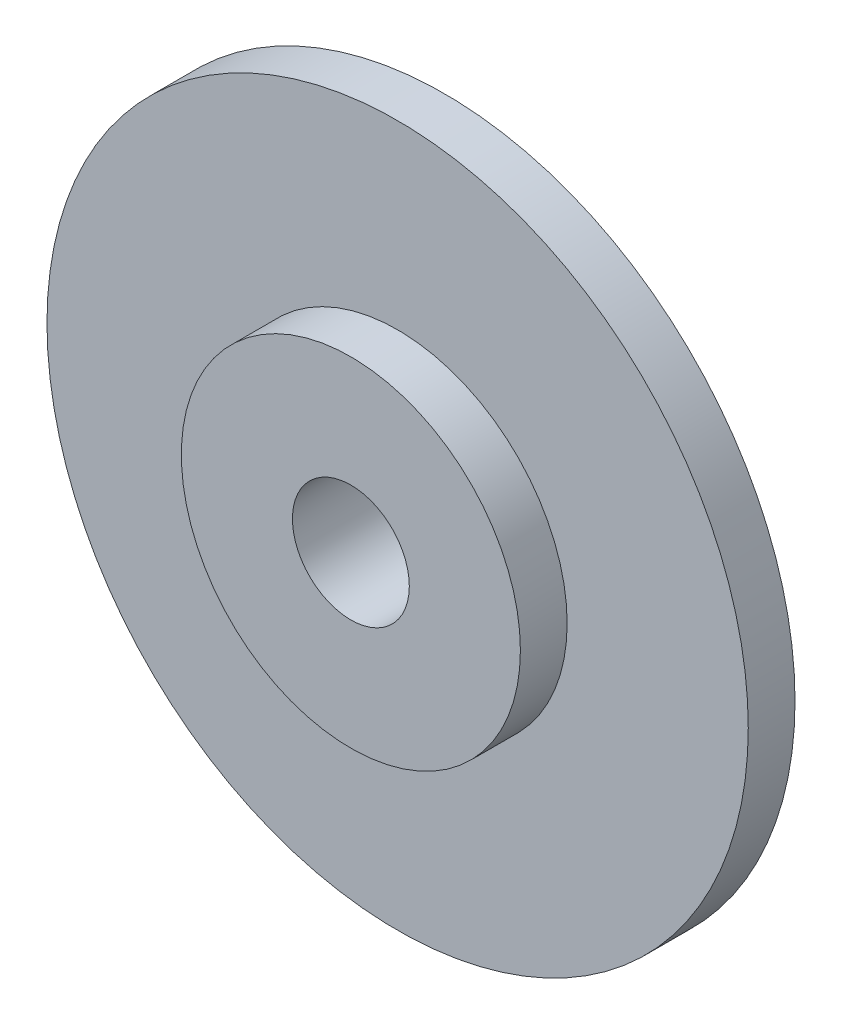
from build123d import *

# Parameters (mm, degrees)
SKETCH1_R           = 47.625
BOSS_EXTRUDE1_DEPTH = 6.35
SKETCH2_R           = 23.0251
BOSS_EXTRUDE2_DEPTH = 6.35
SKETCH4_R           = 7.9375
CUT_EXTRUDE2_DEPTH  = 69.538830235


with BuildPart() as part:
    # Sketch1 → Boss-Extrude1 (new body)
    with BuildSketch(Plane.XY):
        Circle(SKETCH1_R)
    extrude(amount=BOSS_EXTRUDE1_DEPTH)

    # Sketch2 → Boss-Extrude2 (add)
    with BuildSketch(Plane.XY.offset(6.35)):
        Circle(SKETCH2_R)
    extrude(amount=BOSS_EXTRUDE2_DEPTH)

    # Sketch4 → Cut-Extrude2 (cut, through all)
    with BuildSketch(Plane.XY):
        Circle(SKETCH4_R)
    extrude(amount=CUT_EXTRUDE2_DEPTH, mode=Mode.SUBTRACT)


solid = part.part
